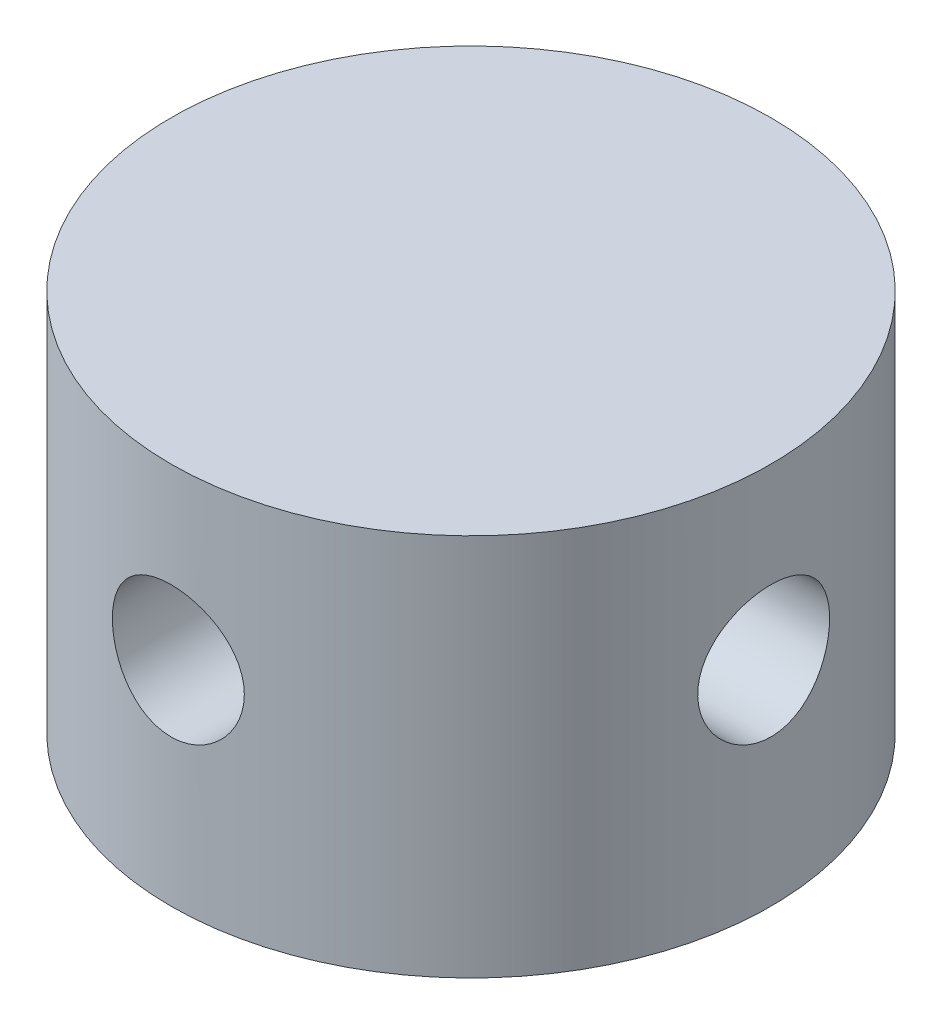
from build123d import *

# Parameters (mm, degrees)
SKETCH1_R           = 14.1
BOSS_EXTRUDE1_DEPTH = 18
SKETCH2_R           = 3.1
CUT_EXTRUDE1_DEPTH  = 9
CIRPATTERN1_COUNT   = 4


with BuildPart() as part:
    # Sketch1 → Boss-Extrude1 (new body)
    with BuildSketch(Plane(origin=(0, 0, 0), x_dir=(1, 0, 0), z_dir=(0, 1, 0))):
        Circle(SKETCH1_R)
    extrude(amount=BOSS_EXTRUDE1_DEPTH)

    # Sketch2 → Cut-Extrude1 (cut)
    with BuildSketch(Plane(origin=(14.1, 0, 0), x_dir=(0, 0, -1), z_dir=(1, 0, 0))):
        with Locations((0, 9.995362646)):
            Circle(SKETCH2_R)
    cut_extrude1 = extrude(amount=-CUT_EXTRUDE1_DEPTH, mode=Mode.SUBTRACT)

    # CirPattern1: Cut-Extrude1 ×4 about axis
    cirpattern1_axis = Axis((0, 18, 0), (0, -1, 0))
    for i in range(1, CIRPATTERN1_COUNT):
        add(cut_extrude1.rotate(cirpattern1_axis, i * 360 / CIRPATTERN1_COUNT), mode=Mode.SUBTRACT)


solid = part.part
